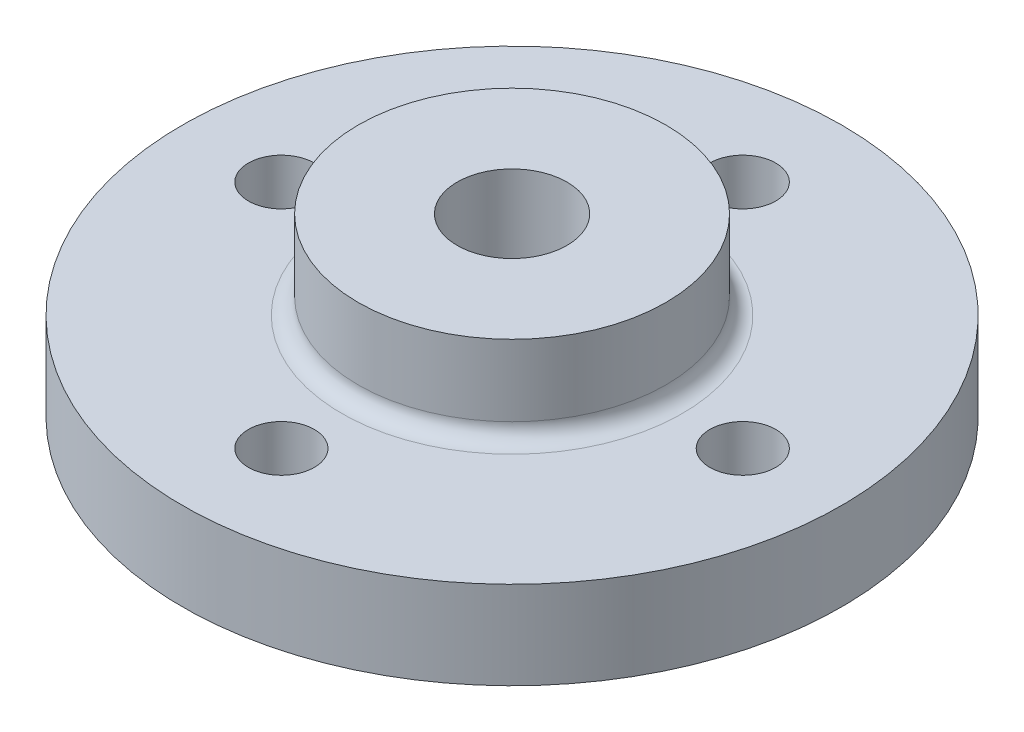
from build123d import *

# Parameters (mm, degrees)
F_12_0MM_DOWEL_HOLE1_D = 12
CIRPATTERN1_COUNT      = 4


with BuildPart() as part:
    # Sketch1 → Revolve1 (revolve)
    with BuildSketch(Plane.XY, mode=Mode.PRIVATE) as revolve1_sk:
        with BuildLine():
            Line((-60, 0), (-60, 16))
            Line((-60, 16), (-31, 16))
            ThreePointArc((-31, 16), (-28.878679656, 16.878679656), (-28, 19))
            Line((-28, 19), (-28, 32))
            Line((-28, 32), (-10, 32))
            Line((-10, 32), (-10, 12))
            Line((-10, 12), (-23, 12))
            Line((-23, 12), (-23, 0))
            Line((-23, 0), (-60, 0))
        make_face()
    revolve(revolve1_sk.sketch.rotate(Axis((0, 0, 0), (0, 1, 0)), 270), axis=Axis((0, 0, 0), (0, 1, 0)))

    # Ø12.0mm Dowel Hole1 (through all)
    with Locations(Plane.XZ):
        with Locations((0, 42)):
            f_12_0mm_dowel_hole1 = Hole(F_12_0MM_DOWEL_HOLE1_D / 2)

    # CirPattern1: Ø12.0mm Dowel Hole1 ×4 about axis
    cirpattern1_axis = Axis((0, 0, 0), (0, 1, 0))
    for i in range(1, CIRPATTERN1_COUNT):
        add(f_12_0mm_dowel_hole1.rotate(cirpattern1_axis, i * 360 / CIRPATTERN1_COUNT), mode=Mode.SUBTRACT)


solid = part.part
